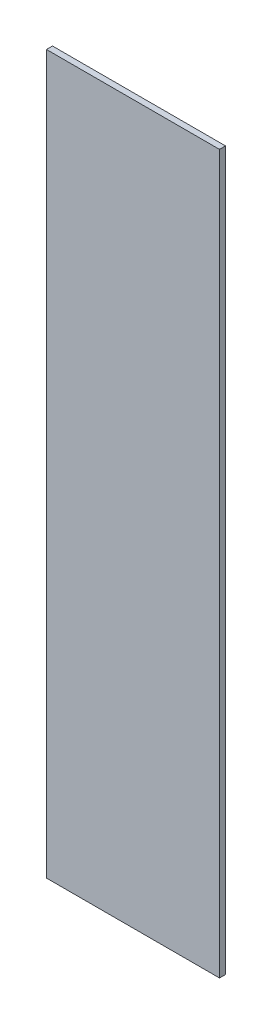
from build123d import *

# Parameters (mm, degrees)
SKETCH1_W           = 115
SKETCH1_H           = 477
BOSS_EXTRUDE1_DEPTH = 4


with BuildPart() as part:
    # Sketch1 → Boss-Extrude1 (new body)
    with BuildSketch(Plane.XY):
        Rectangle(SKETCH1_W, SKETCH1_H)
    extrude(amount=BOSS_EXTRUDE1_DEPTH)


solid = part.part
